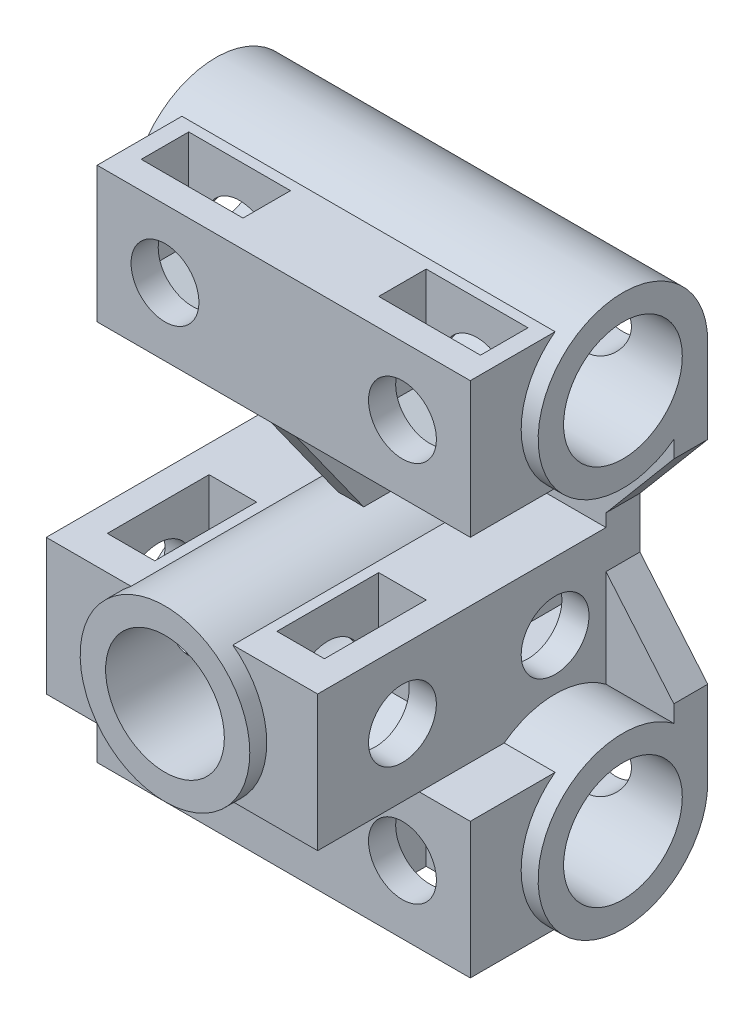
from build123d import *

# Parameters (mm, degrees)
SKETCH1_R                = 5
SKETCH1_R_2              = 3.5
BOSS_EXTRUDE1_DEPTH      = 20
BOSS_EXTRUDE3_DEPTH      = 12
BOSS_EXTRUDE3_DEPTH_BACK = 12
SKETCH4_R                = 5
BOSS_EXTRUDE4_DEPTH      = 4
BOSS_EXTRUDE4_DEPTH_BACK = 14
SKETCH9_R                = 3.5
BOSS_EXTRUDE6_DEPTH      = 2
BOSS_EXTRUDE7_START      = -11
BOSS_EXTRUDE7_DEPTH      = 22
SKETCH13_R               = 2
CUT_EXTRUDE3_DEPTH       = 13
CUT_EXTRUDE4_DEPTH       = 1.4
CUT_EXTRUDE5_DEPTH       = 31.401480397
CUT_EXTRUDE5_DEPTH_BACK  = 31.401480397
SKETCH15_R               = 2
CUT_EXTRUDE6_DEPTH       = 1.4
CUT_EXTRUDE11_DEPTH      = 1.4
BOSS_EXTRUDE8_DEPTH      = 0.75
SKETCH20_R               = 3.5
CUT_EXTRUDE9_DEPTH       = 31.401480397
CUT_EXTRUDE10_REACH      = 38.827
SKETCH21_R               = 3.5


with BuildPart() as part:
    # Sketch1 → Boss-Extrude1 (new body)
    with BuildSketch(Plane.XY):
        Circle(SKETCH1_R)
        Circle(SKETCH1_R_2, mode=Mode.SUBTRACT)
    extrude(amount=BOSS_EXTRUDE1_DEPTH)

    # Sketch4 → Boss-Extrude3 (add, two sides: drawn at the far end of the back side and taken through both)
    with BuildSketch(Plane(origin=(0, 0, 0), x_dir=(0, 0, -1), z_dir=(1, 0, 0)).offset(-BOSS_EXTRUDE3_DEPTH_BACK)):
        with Locations((-5, 14.5)):
            Circle(SKETCH4_R)
        with Locations((-5, -8)):
            Circle(SKETCH4_R)
    extrude(amount=BOSS_EXTRUDE3_DEPTH + BOSS_EXTRUDE3_DEPTH_BACK)


with BuildPart() as boss_extrude3_piece_1:
    # of the separate pieces the step leaves, piece 1, a body of its own (boss_extrude3_pieces)
    add(part.part.solids().sort_by_distance((5, 0, 0))[0])

    # Sketch6 → Boss-Extrude4 (add, two sides: drawn at the far end of the back side and taken through both)
    with BuildSketch(Plane(origin=(0, 0, 5), x_dir=(-1, 0, 0), z_dir=(0, 0, -1)).offset(-BOSS_EXTRUDE4_DEPTH_BACK)):
        with BuildLine():
            Line((3, 4), (8, 4))
            Line((8, 4), (8, -4))
            Line((8, -4), (3, -4))
            ThreePointArc((3, -4), (5, 0), (3, 4))
        make_face()
        with BuildLine():
            Line((-3, 4), (-8, 4))
            Line((-8, 4), (-8, -4))
            Line((-8, -4), (-3, -4))
            ThreePointArc((-3, -4), (-5, 0), (-3, 4))
        make_face()
    extrude(amount=BOSS_EXTRUDE4_DEPTH + BOSS_EXTRUDE4_DEPTH_BACK)

    # Sketch9 → Boss-Extrude6 (add)
    with BuildSketch(Plane.XY):
        Polygon((12, 14.5), (-12, 14.5), (-12, 9.5), (-8, 4.75), (-8, 1.75), (-12, -3), (-12, -8), (12, -8), (12, -3), (8, 1.75), (8, 4.75), (12, 9.5), align=None)
        Circle(SKETCH9_R, mode=Mode.SUBTRACT)
    extrude(amount=BOSS_EXTRUDE6_DEPTH)



with BuildPart() as boss_extrude3_piece_2:
    # of the separate pieces the step leaves, piece 2, a body of its own (boss_extrude3_pieces)
    add(part.part.solids().sort_by_distance((0, 14.5, 0))[0])


with BuildPart() as boss_extrude3_piece_1_1:
    add(boss_extrude3_piece_1.part)

    add(boss_extrude3_piece_2.part)  # Boss-Extrude7 merges Boss-Extrude3 piece 2
    # Sketch11 → Boss-Extrude7 (add)
    with BuildSketch(Plane(origin=(0, 0, 0), x_dir=(0, 0, -1), z_dir=(1, 0, 0)).offset(BOSS_EXTRUDE7_START)):
        with BuildLine():
            Line((-8, 18.5), (-13, 18.5))
            Line((-13, 18.5), (-13, 10.5))
            Line((-13, 10.5), (-8, 10.5))
            ThreePointArc((-8, 10.5), (-10, 14.5), (-8, 18.5))
        make_face()
        with BuildLine():
            Line((-8, -12), (-13, -12))
            Line((-13, -12), (-13, -4))
            Line((-13, -4), (-8, -4))
            ThreePointArc((-8, -4), (-10, -8), (-8, -12))
        make_face()
    extrude(amount=BOSS_EXTRUDE7_DEPTH)

    # Sketch13 → Cut-Extrude3 (cut)
    with BuildSketch(Plane.XY):
        with Locations(Location((7, 14.5, 0), (0, 0, 180))):
            Circle(SKETCH13_R)
        with Locations(Location((-7, 14.5, 0), (0, 0, 180))):
            Circle(SKETCH13_R)
        with Locations(Location((7, -8, 0), (0, 0, 180))):
            Circle(SKETCH13_R)
        with Locations(Location((-7, -8, 0), (0, 0, 180))):
            Circle(SKETCH13_R)
    extrude(amount=CUT_EXTRUDE3_DEPTH, mode=Mode.SUBTRACT)

    # Sketch14 → Cut-Extrude4 (cut, symmetric)
    with BuildSketch(Plane(origin=(0, 0, 10), x_dir=(-1, 0, 0), z_dir=(0, 0, -1))):
        Polygon((4, 16.232050808), (4, 19.5), (10, 19.5), (10, 16.232050808), (10, 12.767949192), (7, 11.035898385), (4, 12.767949192), align=None)
        Polygon((-10, 16.232050808), (-10, 12.767949192), (-7, 11.035898385), (-4, 12.767949192), (-4, 16.232050808), (-4, 19.5), (-10, 19.5), align=None)
        Polygon((-7, -4.535898385), (-10, -6.267949192), (-10, -9.732050808), (-10, -13), (-4, -13), (-4, -9.732050808), (-4, -6.267949192), align=None)
        Polygon((7, -4.535898385), (4, -6.267949192), (4, -9.732050808), (4, -13), (10, -13), (10, -9.732050808), (10, -6.267949192), align=None)
    extrude(amount=CUT_EXTRUDE4_DEPTH, both=True, mode=Mode.SUBTRACT)

    # Sketch15 → Cut-Extrude5 (cut, two sides: drawn at the far end of the back side and taken through both)
    with BuildSketch(Plane(origin=(0, 0, 0), x_dir=(0, 0, -1), z_dir=(1, 0, 0)).offset(-CUT_EXTRUDE5_DEPTH_BACK)):
        with Locations(Location((-5, 0, 0), (0, 0, 180))):
            Circle(SKETCH15_R)
        with Locations(Location((-14, 0, 0), (0, 0, 180))):
            Circle(SKETCH15_R)
    extrude(amount=CUT_EXTRUDE5_DEPTH + CUT_EXTRUDE5_DEPTH_BACK, mode=Mode.SUBTRACT)

    # Sketch16 → Cut-Extrude6 (cut, symmetric)
    with BuildSketch(Plane(origin=(-5, 0, 0), x_dir=(0, 0, -1), z_dir=(1, 0, 0))):
        Polygon((-17, 1.732050808), (-17, 5), (-11, 5), (-11, 1.732050808), (-11, -1.732050808), (-14, -3.464101615), (-17, -1.732050808), align=None)
        Polygon((-3.267949192, 3), (-6.732050808, 3), (-8.464101615, 0), (-6.732050808, -3), (-3.267949192, -3), (0, -3), (0, 3), align=None)
    extrude(amount=CUT_EXTRUDE6_DEPTH, both=True, mode=Mode.SUBTRACT)

    # Sketch22 → Cut-Extrude11 (cut, symmetric)
    with BuildSketch(Plane(origin=(5, 0, 0), x_dir=(0, 0, -1), z_dir=(1, 0, 0))):
        Polygon((-17, 1.732050808), (-17, 5), (-11, 5), (-11, 1.732050808), (-11, -1.732050808), (-14, -3.464101615), (-17, -1.732050808), align=None)
        Polygon((-3.267949192, 3), (-6.732050808, 3), (-8.464101615, 0), (-6.732050808, -3), (-3.267949192, -3), (0, -3), (0, 3), align=None)
    extrude(amount=CUT_EXTRUDE11_DEPTH, both=True, mode=Mode.SUBTRACT)

    # Sketch23 → Boss-Extrude8 (add, symmetric)
    with BuildSketch(Plane(origin=(0, 0, 0), x_dir=(0, 0, -1), z_dir=(1, 0, 0))):
        with BuildLine():
            Line((-8, 10.5), (-13, 10.5))
            Line((-13, 10.5), (-8, 3.5))
            Line((-8, 3.5), (-2, 3.5))
            Line((-2, 3.5), (-2, 10.5))
            ThreePointArc((-2, 10.5), (-5, 9.5), (-8, 10.5))
        make_face()
    extrude(amount=BOSS_EXTRUDE8_DEPTH, both=True)

    # Sketch20 → Cut-Extrude9 (cut, through all)
    with BuildSketch(Plane.XY):
        Circle(SKETCH20_R)
    extrude(amount=CUT_EXTRUDE9_DEPTH, mode=Mode.SUBTRACT)

    # Cut-Extrude10: up to this face of the body (flat: up to its plane)
    cut_extrude10_end = Plane(boss_extrude3_piece_1_1.part.faces().sort_by_distance((-12, 14.303090972, 4.774961111))[0])
    # Sketch21 → Cut-Extrude10 (cut, up to the picked face)
    with BuildSketch(Plane(origin=(12, 0, 0), x_dir=(0, 0, -1), z_dir=(1, 0, 0)), mode=Mode.PRIVATE) as cut_extrude10_sk1:
        with Locations((-5, 14.5)):
            Circle(SKETCH21_R)
    cut_extrude10_tool1 = split(extrude(cut_extrude10_sk1.sketch, amount=-CUT_EXTRUDE10_REACH, mode=Mode.PRIVATE), bisect_by=cut_extrude10_end, keep=Keep.BOTH, mode=Mode.PRIVATE)
    # Sketch21 → Cut-Extrude10 (cut, up to the picked face)
    with BuildSketch(Plane(origin=(12, 0, 0), x_dir=(0, 0, -1), z_dir=(1, 0, 0)), mode=Mode.PRIVATE) as cut_extrude10_sk2:
        with Locations((-5, -8)):
            Circle(SKETCH21_R)
    cut_extrude10_tool2 = split(extrude(cut_extrude10_sk2.sketch, amount=-CUT_EXTRUDE10_REACH, mode=Mode.PRIVATE), bisect_by=cut_extrude10_end, keep=Keep.BOTH, mode=Mode.PRIVATE)
    add(cut_extrude10_tool1.solids().sort_by(Axis((12, 14.5, 5), (-1, 0, 0)))[0], mode=Mode.SUBTRACT)
    add(cut_extrude10_tool2.solids().sort_by(Axis((12, -8, 5), (-1, 0, 0)))[0], mode=Mode.SUBTRACT)


solid = boss_extrude3_piece_1_1.part
